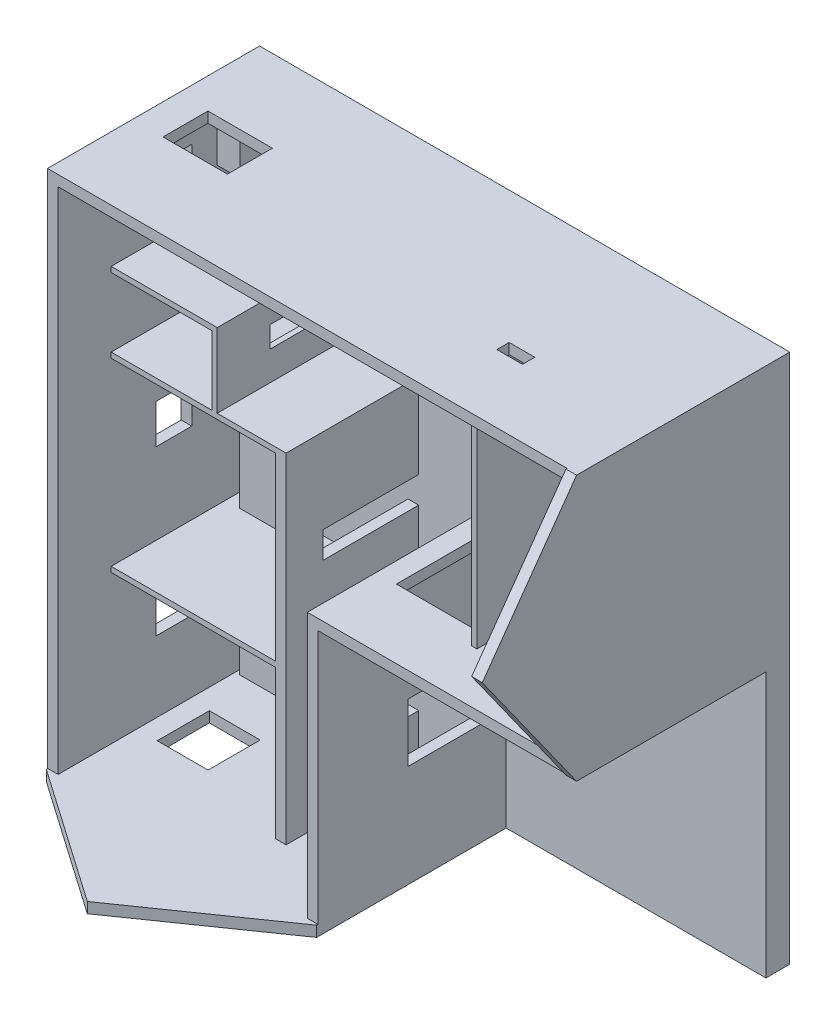
from build123d import *

# Parameters (mm, degrees)
BOSS_EXTRUDE1_DEPTH  = 40
SKETCH1_19_W         = 2
SKETCH1_19_H         = 96
BOSS_EXTRUDE3_DEPTH  = 40
SKETCH1_20_W         = 98
SKETCH1_20_H         = 2
BOSS_EXTRUDE4_DEPTH  = 40
BOSS_EXTRUDE5_DEPTH  = 40
SKETCH1_23_W         = 31
SKETCH1_23_H         = 1
BOSS_EXTRUDE6_DEPTH  = 30
SKETCH1_28_W         = 2
SKETCH1_28_H         = 33
SKETCH1_28_H_2       = 30
BOSS_EXTRUDE7_DEPTH  = 30
SKETCH1_31_W         = 27
SKETCH1_31_H         = 46
SKETCH1_31_W_2       = 31
SKETCH1_31_H_2       = 32
SKETCH1_31_H_3       = 30
BOSS_EXTRUDE9_DEPTH  = 5
SKETCH5_W            = 31
SKETCH5_H            = 1
BOSS_EXTRUDE10_DEPTH = 5
BOSS_EXTRUDE15_DEPTH = 5
SKETCH8_W            = 25
SKETCH8_H            = 1
BOSS_EXTRUDE16_DEPTH = 31
SKETCH9_W            = 1
SKETCH9_H            = 46
BOSS_EXTRUDE17_DEPTH = 30
BOSS_EXTRUDE18_DEPTH = 25
SKETCH11_W           = 18
SKETCH11_H           = 5
CUT_EXTRUDE1_DEPTH   = 25
SKETCH12_W           = 15
SKETCH12_H           = 4
CUT_EXTRUDE2_DEPTH   = 17
SKETCH13_W           = 15
SKETCH13_H           = 5
CUT_EXTRUDE3_DEPTH   = 17
SKETCH15_W           = 11
SKETCH15_H           = 18
CUT_EXTRUDE7_DEPTH   = 22
SKETCH17_W           = 49
SKETCH17_H           = 5
BOSS_EXTRUDE20_DEPTH = 50
SKETCH23_W           = 18
SKETCH23_H           = 11
CUT_EXTRUDE10_DEPTH  = 6
SKETCH24_W           = 3.857458034
SKETCH24_H           = 18
CUT_EXTRUDE11_DEPTH  = 6
SKETCH25_W           = 14.857458034
SKETCH25_H           = 4
CUT_EXTRUDE12_DEPTH  = 6
SKETCH26_W           = 12.325590262
SKETCH26_H           = 8.454809573
CUT_EXTRUDE13_DEPTH  = 6
SKETCH29_W           = 6.734769559
SKETCH29_H           = 7.400595738
SKETCH29_H_2         = 6.996236091
SKETCH29_H_3         = 6.822092061
CUT_EXTRUDE18_DEPTH  = 6
SKETCH30_W           = 9.583557861
SKETCH30_H           = 9.826587516
CUT_EXTRUDE19_DEPTH  = 6
SKETCH32_W           = 9.286114252
SKETCH32_H           = 19.302332314
SKETCH32_H_2         = 23.610794175
BOSS_EXTRUDE23_DEPTH = 6
SKETCH34_R           = 4.971310263
BOSS_EXTRUDE25_DEPTH = 6
SKETCH35_W           = 2.681833229
SKETCH35_H           = 3.124257682
SKETCH35_W_2         = 2.353550061
SKETCH35_H_2         = 3.124257683
BOSS_EXTRUDE26_DEPTH = 3
SKETCH36_W           = 9.194859164
SKETCH36_H           = 8.554319738
CUT_EXTRUDE20_DEPTH  = 13
BOSS_EXTRUDE28_DEPTH = 18
CUT_EXTRUDE22_DEPTH  = 18
BOSS_EXTRUDE29_DEPTH = 18
CUT_EXTRUDE23_DEPTH  = 18
BOSS_EXTRUDE32_DEPTH = 25
CUT_EXTRUDE24_DEPTH  = 11
SKETCH50_W           = 12
SKETCH50_H           = 20.388751342
BOSS_EXTRUDE34_DEPTH = 6
SKETCH53_W           = 4.839229205
SKETCH53_H           = 2.321938391
CUT_EXTRUDE28_DEPTH  = 6
SKETCH54_W           = 12.153021564
SKETCH54_H           = 8.476910648
CUT_EXTRUDE29_DEPTH  = 6
SKETCH55_W           = 4.321031563
SKETCH55_H           = 11.474788053
BOSS_EXTRUDE36_DEPTH = 5
SKETCH56_R           = 3.581393844
CUT_EXTRUDE30_DEPTH  = 0.5
SKETCH57_W           = 49
SKETCH57_H           = 50
CUT_EXTRUDE31_DEPTH  = 0.5


with BuildPart() as part:
    # Sketch1 → Boss-Extrude1 (new body)
    with BuildSketch(Plane.XY):
        Polygon((1, -50), (1, 2), (-1, 2), (-1, -48), (-50, -48), (-50, -50), align=None)
    extrude(amount=BOSS_EXTRUDE1_DEPTH)

    # Sketch1<19> → Boss-Extrude3 (add)
    with BuildSketch(Plane.XY):
        with Locations((-49, 0)):
            Rectangle(SKETCH1_19_W, SKETCH1_19_H)
    extrude(amount=BOSS_EXTRUDE3_DEPTH)

    # Sketch1<20> → Boss-Extrude4 (add)
    with BuildSketch(Plane.XY):
        with Locations((-1, 49)):
            Rectangle(SKETCH1_20_W, SKETCH1_20_H)
    extrude(amount=BOSS_EXTRUDE4_DEPTH)

    # Sketch1<21> → Boss-Extrude5 (add)
    with BuildSketch(Plane.XY):
        Polygon((50, 50), (48, 50), (48, 2), (1, 2), (1, 0), (50, 0), align=None)
    extrude(amount=BOSS_EXTRUDE5_DEPTH)

    # Sketch1<23> → Boss-Extrude6 (add)
    with BuildSketch(Plane.XY):
        with Locations((-32.5, 15.5)):
            Rectangle(SKETCH1_23_W, SKETCH1_23_H)
    extrude(amount=BOSS_EXTRUDE6_DEPTH)

    # Sketch1<28> → Boss-Extrude7 (add)
    with BuildSketch(Plane.XY):
        with Locations((-16, -0.5)):
            Rectangle(SKETCH1_28_W, SKETCH1_28_H)
        with Locations((-16, -33)):
            Rectangle(SKETCH1_28_W, SKETCH1_28_H_2)
    extrude(amount=BOSS_EXTRUDE7_DEPTH)

    # Sketch1<31> → Boss-Extrude9 (add)
    with BuildSketch(Plane.XY):
        with Locations((34.5, 25)):
            Rectangle(SKETCH1_31_W, SKETCH1_31_H)
        Polygon((20, 2), (20, 48), (-48, 48), (-48, 16), (-15, 16), (-15, -48), (-1, -48), (-1, 2), align=None)
        with Locations((-32.5, -1)):
            Rectangle(SKETCH1_31_W_2, SKETCH1_31_H_2)
        with Locations((-32.5, -33)):
            Rectangle(SKETCH1_31_W_2, SKETCH1_31_H_3)
    extrude(amount=BOSS_EXTRUDE9_DEPTH)

    # Sketch5 → Boss-Extrude10 (add)
    with BuildSketch(Plane.XY.offset(5)):
        with Locations((-32.5, -17.5)):
            Rectangle(SKETCH5_W, SKETCH5_H)
    extrude(amount=-BOSS_EXTRUDE10_DEPTH)

    # Sketch7 → Boss-Extrude15 (add)
    with BuildSketch(Plane.XZ.offset(17)):
        Polygon((-17, 30), (-15, 30), (-15, 5), (-15, 0), (-17, 0), (-17, 5), align=None)
    extrude(amount=BOSS_EXTRUDE15_DEPTH)

    # Sketch8 → Boss-Extrude16 (add)
    with BuildSketch(Plane(origin=(-48, 0, 0), x_dir=(0, 0, -1), z_dir=(1, 0, 0))):
        with Locations((-17.5, -19.5)):
            Rectangle(SKETCH8_W, SKETCH8_H)
    extrude(amount=BOSS_EXTRUDE16_DEPTH)

    # Sketch9 → Boss-Extrude17 (add)
    with BuildSketch(Plane(origin=(0, 0, 0), x_dir=(-1, 0, 0), z_dir=(0, 0, -1))):
        with Locations((-20.5, 25)):
            Rectangle(SKETCH9_W, SKETCH9_H)
    extrude(amount=-BOSS_EXTRUDE17_DEPTH)

    # Sketch10 → Boss-Extrude18 (add)
    with BuildSketch(Plane.XY.offset(5)):
        Polygon((-29, 29), (-29, 16), (-28, 16), (-28, 30), (-48, 30), (-48, 29), align=None)
    extrude(amount=BOSS_EXTRUDE18_DEPTH)

    # Sketch11 → Cut-Extrude1 (cut)
    with BuildSketch(Plane(origin=(-15, 0, 0), x_dir=(0, 0, -1), z_dir=(1, 0, 0))):
        with Locations((-14, -36.060604297)):
            Rectangle(SKETCH11_W, SKETCH11_H)
        with Locations((-14, -2.5)):
            Rectangle(SKETCH11_W, SKETCH11_H)
    extrude(amount=-CUT_EXTRUDE1_DEPTH, mode=Mode.SUBTRACT)

    # Sketch12 → Cut-Extrude2 (cut)
    with BuildSketch(Plane(origin=(-28, 0, 0), x_dir=(0, 0, -1), z_dir=(1, 0, 0))):
        with Locations((-12.5, 23.495124875)):
            Rectangle(SKETCH12_W, SKETCH12_H)
    extrude(amount=-CUT_EXTRUDE2_DEPTH, mode=Mode.SUBTRACT)

    # Sketch13 → Cut-Extrude3 (cut)
    with BuildSketch(Plane(origin=(21, 0, 0), x_dir=(0, 0, -1), z_dir=(1, 0, 0))):
        with Locations((-12.5, 4.5)):
            Rectangle(SKETCH13_W, SKETCH13_H)
    extrude(amount=-CUT_EXTRUDE3_DEPTH, mode=Mode.SUBTRACT)

    # Sketch15 → Cut-Extrude7 (cut)
    with BuildSketch(Plane(origin=(0, 2, 0), x_dir=(1, 0, 0), z_dir=(0, 1, 0))):
        with Locations((8.296242954, -14)):
            Rectangle(SKETCH15_W, SKETCH15_H)
    extrude(amount=-CUT_EXTRUDE7_DEPTH, mode=Mode.SUBTRACT)

    # Sketch17 → Boss-Extrude20 (add)
    with BuildSketch(Plane.XZ):
        with Locations((25.5, 2.5)):
            Rectangle(SKETCH17_W, SKETCH17_H)
    extrude(amount=BOSS_EXTRUDE20_DEPTH)

    # Sketch23 → Cut-Extrude10 (cut)
    with BuildSketch(Plane(origin=(1, 0, 0), x_dir=(0, 0, -1), z_dir=(1, 0, 0))):
        with Locations((-14, -25.178566895)):
            Rectangle(SKETCH23_W, SKETCH23_H)
    extrude(amount=-CUT_EXTRUDE10_DEPTH, mode=Mode.SUBTRACT)

    # Sketch24 → Cut-Extrude11 (cut)
    with BuildSketch(Plane.XZ):
        with Locations((15.724971971, 14)):
            Rectangle(SKETCH24_W, SKETCH24_H)
    extrude(amount=-CUT_EXTRUDE11_DEPTH, mode=Mode.SUBTRACT)

    # Sketch25 → Cut-Extrude12 (cut)
    with BuildSketch(Plane.XZ):
        with Locations((10.224971971, 25)):
            Rectangle(SKETCH25_W, SKETCH25_H)
    extrude(amount=-CUT_EXTRUDE12_DEPTH, mode=Mode.SUBTRACT)

    # Sketch26 → Cut-Extrude13 (cut)
    with BuildSketch(Plane.XZ):
        with Locations((33.468904558, 23.262096897)):
            Rectangle(SKETCH26_W, SKETCH26_H)
    extrude(amount=-CUT_EXTRUDE13_DEPTH, mode=Mode.SUBTRACT)

    # Sketch29 → Cut-Extrude18 (cut)
    with BuildSketch(Plane.ZY.offset(50)):
        with Locations((18.165266651, 0)):
            Rectangle(SKETCH29_W, SKETCH29_H)
        with Locations((18.165266651, -31.10269552)):
            Rectangle(SKETCH29_W, SKETCH29_H_2)
        with Locations((18.165266651, 38.936331186)):
            Rectangle(SKETCH29_W, SKETCH29_H_3)
    extrude(amount=-CUT_EXTRUDE18_DEPTH, mode=Mode.SUBTRACT)

    # Sketch30 → Cut-Extrude19 (cut)
    with BuildSketch(Plane.XZ.offset(50)):
        with Locations((-39.37019483, 20.234587946)):
            Rectangle(SKETCH30_W, SKETCH30_H)
    extrude(amount=-CUT_EXTRUDE19_DEPTH, mode=Mode.SUBTRACT)

    # Sketch32 → Boss-Extrude23 (add)
    with BuildSketch(Plane.XY.offset(5)):
        with Locations((-38.104411192, -6.744947462)):
            Rectangle(SKETCH32_W, SKETCH32_H)
        with Locations((-38.104411192, -31.805397088)):
            Rectangle(SKETCH32_W, SKETCH32_H_2)
    extrude(amount=BOSS_EXTRUDE23_DEPTH)

    # Sketch34 → Boss-Extrude25 (add)
    with BuildSketch(Plane.XY.offset(5)):
        with Locations((-2.900130758, 39.277063679)):
            Circle(SKETCH34_R)
    extrude(amount=BOSS_EXTRUDE25_DEPTH)

    # Sketch35 → Boss-Extrude26 (add)
    with BuildSketch(Plane.XY.offset(5)):
        with Locations((5.787877094, 39.474681542)):
            Rectangle(SKETCH35_W, SKETCH35_H)
        with Locations((-11.292879581, 41.036810383)):
            Rectangle(SKETCH35_W_2, SKETCH35_H_2)
    extrude(amount=BOSS_EXTRUDE26_DEPTH)

    # Sketch36 → Cut-Extrude20 (cut)
    with BuildSketch(Plane.XZ.offset(50)):
        with Locations((-7.017388344, 20.443804938)):
            Rectangle(SKETCH36_W, SKETCH36_H)
    extrude(amount=-CUT_EXTRUDE20_DEPTH, mode=Mode.SUBTRACT)

    # Sketch40 → Boss-Extrude28 (add)
    with BuildSketch(Plane.XY.offset(40)):
        Polygon((48, 48), (48, 2), (48, 0), (50, 0), (50, 50), (48, 50), align=None)
    extrude(amount=BOSS_EXTRUDE28_DEPTH)

    # Sketch41 → Cut-Extrude22 (cut)
    with BuildSketch(Plane(origin=(50, 0, 0), x_dir=(0, 0, -1), z_dir=(1, 0, 0))):
        Polygon((-40.211442362, 50), (-58, 50), (-58, 25), align=None)
        Polygon((-40.211442362, 0), (-58, 25), (-58, 0), align=None)
    extrude(amount=-CUT_EXTRUDE22_DEPTH, mode=Mode.SUBTRACT)

    # Sketch42 → Boss-Extrude29 (add)
    with BuildSketch(Plane.XY.offset(40)):
        Polygon((-1, -48), (1, -48), (1, -50), (-50, -50), (-50, -48), (-48, -48), align=None)
    extrude(amount=BOSS_EXTRUDE29_DEPTH)

    # Sketch43 → Cut-Extrude23 (cut)
    with BuildSketch(Plane.XZ.offset(50)):
        Polygon((-50, 40.245812099), (-24.5, 58), (-50, 58), align=None)
        Polygon((1, 58), (-24.5, 58), (1, 40.245812099), align=None)
    extrude(amount=-CUT_EXTRUDE23_DEPTH, mode=Mode.SUBTRACT)

    # Sketch47 → Boss-Extrude32 (add)
    with BuildSketch(Plane.XY.offset(5)):
        Polygon((48, 38), (48, 39), (29, 39), (29, 48), (28, 48), (28, 38), align=None)
    extrude(amount=BOSS_EXTRUDE32_DEPTH)

    # Sketch48 → Cut-Extrude24 (cut)
    with BuildSketch(Plane.ZY.offset(-28)):
        Polygon((5, 41.896438564), (23, 41.896438564), (23, 44.896438564), (5.087880464, 44.896438564), align=None)
    extrude(amount=-CUT_EXTRUDE24_DEPTH, mode=Mode.SUBTRACT)

    # Sketch50 → Boss-Extrude34 (add)
    with BuildSketch(Plane.XY.offset(5)):
        with Locations((41.023523207, 13.182904819)):
            Rectangle(SKETCH50_W, SKETCH50_H)
    extrude(amount=BOSS_EXTRUDE34_DEPTH)

    # Sketch53 → Cut-Extrude28 (cut)
    with BuildSketch(Plane.XZ.offset(-48)):
        with Locations((24.380189742, 26.051851939)):
            Rectangle(SKETCH53_W, SKETCH53_H)
    extrude(amount=-CUT_EXTRUDE28_DEPTH, mode=Mode.SUBTRACT)

    # Sketch54 → Cut-Extrude29 (cut)
    with BuildSketch(Plane(origin=(0, 50, 0), x_dir=(1, 0, 0), z_dir=(0, 1, 0))):
        with Locations((-38.178470098, -19.730015028)):
            Rectangle(SKETCH54_W, SKETCH54_H)
    extrude(amount=-CUT_EXTRUDE29_DEPTH, mode=Mode.SUBTRACT)

    # Sketch55 → Boss-Extrude36 (add)
    with BuildSketch(Plane.XY.offset(5)):
        with Locations((-45.839484219, 42.262605974)):
            Rectangle(SKETCH55_W, SKETCH55_H)
    extrude(amount=BOSS_EXTRUDE36_DEPTH)

    # Sketch56 → Cut-Extrude30 (cut)
    with BuildSketch(Plane.XZ.offset(50)):
        with Locations((-24.321182171, 45.126901368)):
            Circle(SKETCH56_R)
    extrude(amount=-CUT_EXTRUDE30_DEPTH, mode=Mode.SUBTRACT)

    # Sketch57 → Cut-Extrude31 (cut)
    with BuildSketch(Plane.XY.offset(5)):
        with Locations((25.5, -25)):
            Rectangle(SKETCH57_W, SKETCH57_H)
    extrude(amount=-CUT_EXTRUDE31_DEPTH, mode=Mode.SUBTRACT)


solid = part.part
